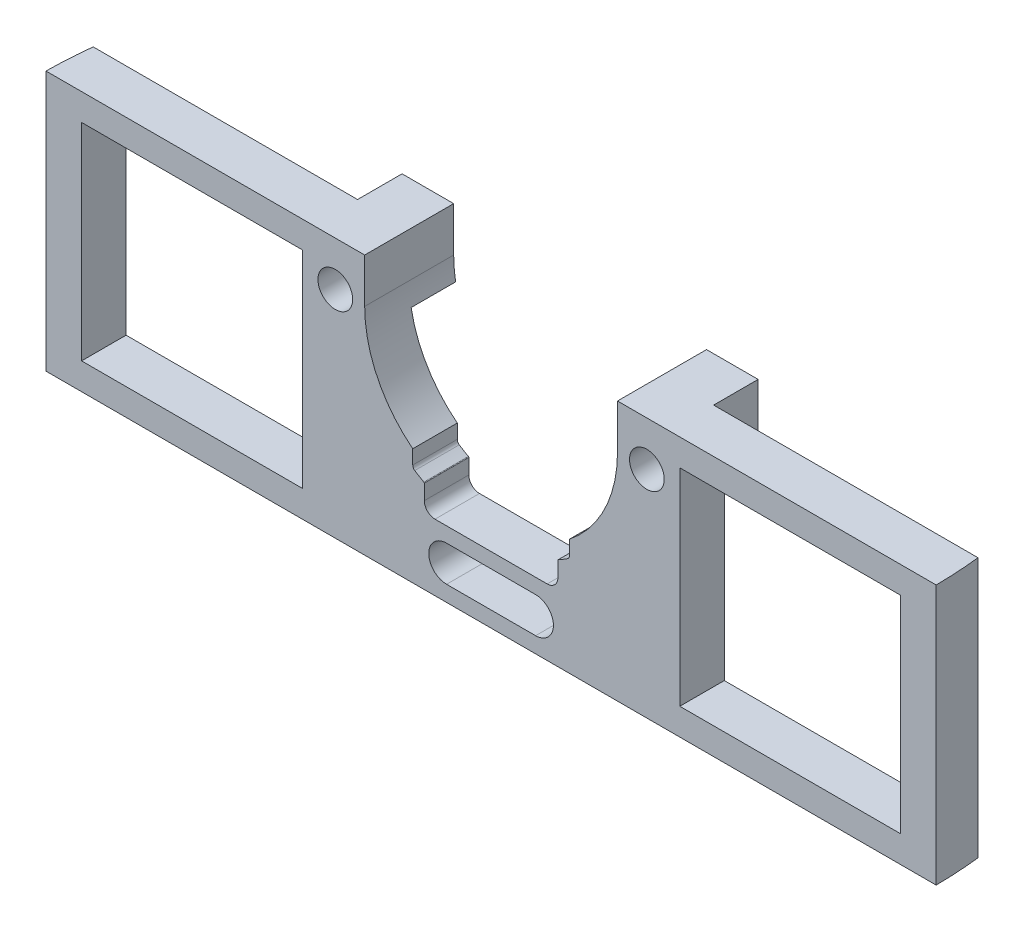
from build123d import *

# Parameters (mm, degrees)
BOSS_EXTRUDE1_DEPTH = 5
SKETCH2_W           = 24.8
SKETCH2_H           = 23.2
CUT_EXTRUDE1_DEPTH  = 5
BOSS_EXTRUDE2_START = 5
BOSS_EXTRUDE2_DEPTH = 5
SKETCH4_R           = 1.95
CUT_EXTRUDE2_DEPTH  = 10
CUT_EXTRUDE3_DEPTH  = 5
CUT_EXTRUDE4_DEPTH  = 29.2


with BuildPart() as part:
    # Sketch1 → Boss-Extrude1 (new body)
    with BuildSketch(Plane.XY):
        with BuildLine():
            Line((14.2, 0), (14.2, 5))
            Line((14.2, 5), (50, 5))
            Line((50, 5), (50, -24.2))
            Line((50, -24.2), (-50, -24.2))
            Line((-50, -24.2), (-50, 5))
            Line((-50, 5), (-14.2, 5))
            Line((-14.2, 5), (-14.2, 0))
            ThreePointArc((-14.2, 0), (0, -14.2), (14.2, 0))
        make_face()
        with BuildLine():
            Line((-5, -18.431553888), (5, -18.431553888))
            ThreePointArc((5, -18.431553888), (7, -20.431553888), (5, -22.431553888))
            Line((5, -22.431553888), (-5, -22.431553888))
            ThreePointArc((-5, -22.431553888), (-7, -20.431553888), (-5, -18.431553888))
        make_face(mode=Mode.SUBTRACT)
    extrude(amount=BOSS_EXTRUDE1_DEPTH)

    # Sketch2 → Cut-Extrude1 (cut)
    with BuildSketch(Plane.XY.offset(5)):
        with Locations((-33.6, -9.6)):
            Rectangle(SKETCH2_W, SKETCH2_H)
        with Locations((33.6, -9.6)):
            Rectangle(SKETCH2_W, SKETCH2_H)
    extrude(amount=-CUT_EXTRUDE1_DEPTH, mode=Mode.SUBTRACT)

    # Sketch3 → Boss-Extrude2 (add)
    with BuildSketch(Plane(origin=(0, 0, 0), x_dir=(-1, 0, 0), z_dir=(0, 0, -1)).offset(BOSS_EXTRUDE2_START)):
        with BuildLine():
            Line((-20, 5), (-20, 0))
            ThreePointArc((-20, 0), (-19.267766953, -1.767766953), (-17.5, -2.5))
            Line((-17.5, -2.5), (-13.978197309, -2.5))
            ThreePointArc((-13.978197309, -2.5), (-14.144440636, -1.25491), (-14.2, 0))
            Line((-14.2, 0), (-14.2, 5))
            Line((-14.2, 5), (-20, 5))
        make_face()
        with BuildLine():
            ThreePointArc((14.2, 0), (14.144440636, -1.25491), (13.978197309, -2.5))
            Line((13.978197309, -2.5), (17.5, -2.5))
            ThreePointArc((17.5, -2.5), (19.267766953, -1.767766953), (20, 0))
            Line((20, 0), (20, 5))
            Line((20, 5), (14.2, 5))
            Line((14.2, 5), (14.2, 0))
        make_face()
    extrude(amount=-BOSS_EXTRUDE2_DEPTH)

    # Sketch4 → Cut-Extrude2 (cut)
    with BuildSketch(Plane(origin=(0, 0, -5), x_dir=(-1, 0, 0), z_dir=(0, 0, -1))):
        with Locations((-17.5, 0)):
            Circle(SKETCH4_R)
        with Locations((17.5, 0)):
            Circle(SKETCH4_R)
    extrude(amount=-CUT_EXTRUDE2_DEPTH, mode=Mode.SUBTRACT)

    # Sketch5 → Cut-Extrude3 (cut)
    with BuildSketch(Plane.XY.offset(5)):
        with BuildLine():
            Line((-7.5, -15.547171584), (-7.5, -13.852075657))
            ThreePointArc((-7.5, -13.852075657), (-7.513947323, -13.801135135), (-7.551898734, -13.764404292))
            ThreePointArc((-7.551898734, -13.764404292), (-8.068261954, -13.46822739), (-8.573026316, -13.15268869))
            ThreePointArc((-8.573026316, -13.15268869), (-8.739609576, -12.972022031), (-8.8, -12.733813254))
            Line((-8.8, -12.733813254), (-8.8, -11.099557513))
            Line((-8.8, -11.099557513), (8.8, -11.099557513))
            Line((8.8, -11.099557513), (8.8, -12.733813254))
            ThreePointArc((8.8, -12.733813254), (8.739609576, -12.972022031), (8.573026316, -13.15268869))
            ThreePointArc((8.573026316, -13.15268869), (8.068261954, -13.46822739), (7.551898734, -13.764404292))
            ThreePointArc((7.551898734, -13.764404292), (7.513947323, -13.801135135), (7.5, -13.852075657))
            Line((7.5, -13.852075657), (7.5, -15.547171584))
            ThreePointArc((7.5, -15.547171584), (7.148528137, -16.395699721), (6.3, -16.747171584))
            Line((6.3, -16.747171584), (-6.3, -16.747171584))
            ThreePointArc((-6.3, -16.747171584), (-7.148528137, -16.395699721), (-7.5, -15.547171584))
        make_face()
    extrude(amount=-CUT_EXTRUDE3_DEPTH, mode=Mode.SUBTRACT)

    # Sketch7 → Cut-Extrude4 (cut)
    with BuildSketch(Plane(origin=(0, 5, 0), x_dir=(1, 0, 0), z_dir=(0, 1, 0))):
        with BuildLine():
            Line((49.696579359, 0), (50, 0))
            Line((50, 0), (50, -5))
            Line((50, -5), (49.997973832, -5.049874854))
            ThreePointArc((49.997973832, -5.049874854), (49.911184048, -2.521123203), (49.696579359, 0))
        make_face()
        with BuildLine():
            Line((-50, -5), (-49.997973832, -5.049874854))
            ThreePointArc((-49.997973832, -5.049874854), (-49.911184048, -2.521123203), (-49.696579359, 0))
            Line((-49.696579359, 0), (-50, 0))
            Line((-50, 0), (-50, -5))
        make_face()
    extrude(amount=-CUT_EXTRUDE4_DEPTH, mode=Mode.SUBTRACT)


solid = part.part
